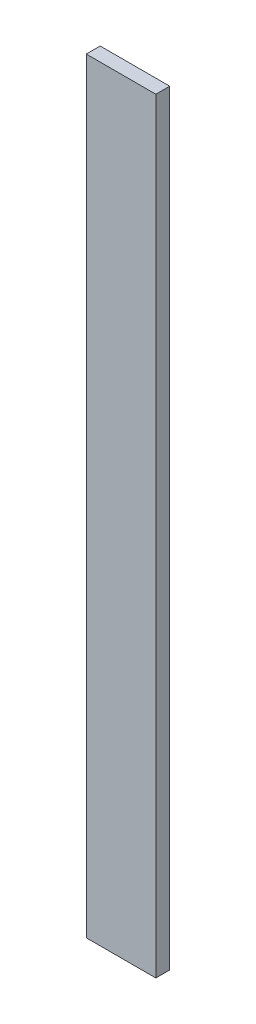
from build123d import *

# Parameters (mm, degrees)
SKETCH_1_W      = 15
SKETCH_1_H      = 165
EXTRUDE_1_DEPTH = 3


with BuildPart() as part:
    # 草图1 → 凸台-拉伸1 (new body)
    with BuildSketch(Plane.XY):
        Rectangle(SKETCH_1_W, SKETCH_1_H)
    extrude(amount=EXTRUDE_1_DEPTH)


solid = part.part
